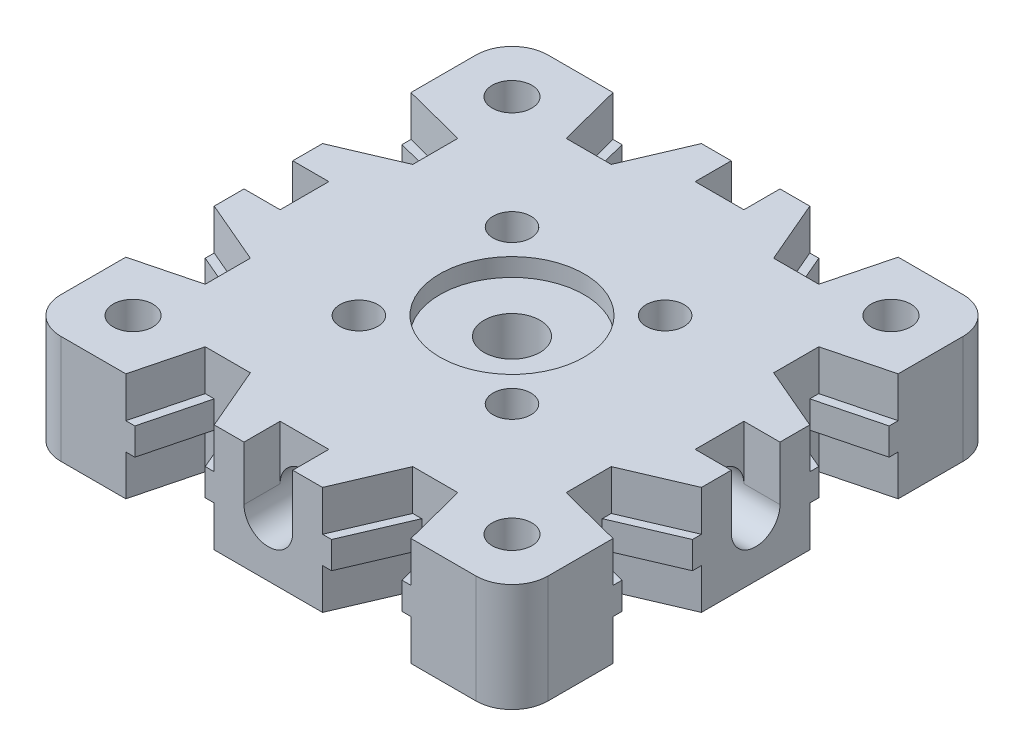
from build123d import *

# Parameters (mm, degrees)
SKETCH_3_W                      = 27
SKETCH_3_H                      = 27
EXTRUDE_1_DEPTH                 = 3
FILLET_1_R                      = 2
SKETCH_4_R                      = 1.1
CUT_EXTRUDE_1_DEPTH             = 6
SKETCH_5_R                      = 1.55
CUT_EXTRUDE_2_DEPTH             = 6
SKETCH_6_R                      = 1.05
CUT_EXTRUDE_3_DEPTH             = 6
PATTERN_CIRCULAR_1_COUNT        = 4
SKETCH_7_R                      = 4
CUT_EXTRUDE_4_DEPTH             = 1
CUT_EXTRUDE_8_DEPTH             = 21.012496096
PATTERN_CIRCULAR_2_COUNT        = 4
PATTERN_CIRCULAR_2_COPY_1_DEPTH = 21.012496096
PATTERN_CIRCULAR_2_COPY_2_DEPTH = 21.012496096
PATTERN_CIRCULAR_2_COPY_3_DEPTH = 21.012496096
SKETCH_12_R                     = 1.35
CUT_EXTRUDE_9_DEPTH             = 8
PATTERN_CIRCULAR_3_COUNT        = 4
EXTRUDE_2_DEPTH                 = 0.75
PATTERN_CIRCULAR_4_COUNT        = 4
PATTERN_CIRCULAR_4_COPY_1_DEPTH = 0.75
PATTERN_CIRCULAR_4_COPY_2_DEPTH = 0.75
PATTERN_CIRCULAR_4_COPY_3_DEPTH = 0.75
SKETCH_22_W                     = 2.7
SKETCH_22_H                     = 3
CUT_EXTRUDE_15_DEPTH            = 2
PATTERN_CIRCULAR_11_COUNT       = 4


with BuildPart() as part:
    # ｽｹｯﾁ3 → ﾎﾞｽ - 押し出し1 (new, symmetric)
    with BuildSketch(Plane(origin=(0, 0, 0), x_dir=(1, 0, 0), z_dir=(0, 1, 0))):
        Rectangle(SKETCH_3_W, SKETCH_3_H)
    extrude(amount=EXTRUDE_1_DEPTH, both=True)

    # ﾌｨﾚｯﾄ1
    fillet_1_edges = [part.edges().sort_by_distance(p)[0] for p in [
        (13.5, 0, 13.5),
        (-13.5, 0, 13.5),
        (-13.5, 0, -13.5),
        (13.5, 0, -13.5),
    ]]
    fillet(fillet_1_edges, radius=FILLET_1_R)

    # ｽｹｯﾁ4 → ｶｯﾄ - 押し出し1 (cut)
    with BuildSketch(Plane(origin=(0, 3, 0), x_dir=(1, 0, 0), z_dir=(0, 1, 0))):
        with Locations(Location((-10.5, 10.5, 0), (0, 0, 270))):
            Circle(SKETCH_4_R)
        with Locations(Location((10.5, 10.5, 0), (0, 0, 270))):
            Circle(SKETCH_4_R)
        with Locations(Location((-10.5, -10.5, 0), (0, 0, 270))):
            Circle(SKETCH_4_R)
        with Locations(Location((10.5, -10.5, 0), (0, 0, 270))):
            Circle(SKETCH_4_R)
    extrude(amount=-CUT_EXTRUDE_1_DEPTH, mode=Mode.SUBTRACT)

    # ｽｹｯﾁ5 → ｶｯﾄ - 押し出し2 (cut)
    with BuildSketch(Plane(origin=(0, 3, 0), x_dir=(1, 0, 0), z_dir=(0, 1, 0))):
        with Locations(Location((0, 0, 0), (0, 0, 270))):
            Circle(SKETCH_5_R)
    extrude(amount=-CUT_EXTRUDE_2_DEPTH, mode=Mode.SUBTRACT)

    # ｽｹｯﾁ6 → ｶｯﾄ - 押し出し3 (cut)
    with BuildSketch(Plane(origin=(0, 3, 0), x_dir=(1, 0, 0), z_dir=(0, 1, 0))):
        with Locations(Location((4.242640687, 4.242640687, 0), (0, 0, 270))):
            Circle(SKETCH_6_R)
    cut_extrude_3 = extrude(amount=-CUT_EXTRUDE_3_DEPTH, mode=Mode.SUBTRACT)

    # 円形ﾊﾟﾀｰﾝ1: ｶｯﾄ - 押し出し3 ×4 about axis
    pattern_circular_1_axis = Axis((0, 0, 0), (0, 1, 0))
    for i in range(1, PATTERN_CIRCULAR_1_COUNT):
        add(cut_extrude_3.rotate(pattern_circular_1_axis, i * 360 / PATTERN_CIRCULAR_1_COUNT), mode=Mode.SUBTRACT)

    # ｽｹｯﾁ7 → ｶｯﾄ - 押し出し4 (cut)
    with BuildSketch(Plane(origin=(0, 3, 0), x_dir=(1, 0, 0), z_dir=(0, 1, 0))):
        with Locations(Location((0, 0, 0), (0, 0, 270))):
            Circle(SKETCH_7_R)
    extrude(amount=-CUT_EXTRUDE_4_DEPTH, mode=Mode.SUBTRACT)

    # ｽｹｯﾁ11 → ｶｯﾄ - 押し出し8 (cut, symmetric)
    with BuildSketch(Plane(origin=(0, 3, 0), x_dir=(1, 0, 0), z_dir=(0, 1, 0))):
        Polygon((-28.082033535, 86.024744916), (3, 13.5), (4.5, 10), (7, 10), (7.9, 13.5), (27.55047658, 89.918520033), (16.532211377, 247.342544779), (-39.100298738, 243.448769662), align=None)
    cut_extrude_8 = extrude(amount=CUT_EXTRUDE_8_DEPTH, both=True, mode=Mode.SUBTRACT)

    # ﾐﾗｰ1: ｶｯﾄ - 押し出し8 across plane
    add(cut_extrude_8.mirror(Plane(origin=(0, 0, 0), x_dir=(0, 0, 1), z_dir=(1, 0, 0))), mode=Mode.SUBTRACT)

    # 円形ﾊﾟﾀｰﾝ2: ｶｯﾄ - 押し出し8 ×4 about axis
    pattern_circular_2_axis = Axis((0, 0, 0), (0, 1, 0))
    for i in range(1, PATTERN_CIRCULAR_2_COUNT):
        add(cut_extrude_8.rotate(pattern_circular_2_axis, i * 360 / PATTERN_CIRCULAR_2_COUNT), mode=Mode.SUBTRACT)

    # 円形ﾊﾟﾀｰﾝ2 copy 1 sketch → 円形ﾊﾟﾀｰﾝ2 copy 1 (cut, symmetric)
    with BuildSketch(Plane.ZX.offset(3)):
        Polygon((-28.082033535, -86.024744916), (3, -13.5), (4.5, -10), (7, -10), (7.9, -13.5), (27.55047658, -89.918520033), (16.532211377, -247.342544779), (-39.100298738, -243.448769662), align=None)
    extrude(amount=PATTERN_CIRCULAR_2_COPY_1_DEPTH, both=True, mode=Mode.SUBTRACT)

    # 円形ﾊﾟﾀｰﾝ2 copy 2 sketch → 円形ﾊﾟﾀｰﾝ2 copy 2 (cut, symmetric)
    with BuildSketch(Plane(origin=(0, 3, 0), x_dir=(1, 0, 0), z_dir=(0, 1, 0))):
        Polygon((-28.082033535, -86.024744916), (3, -13.5), (4.5, -10), (7, -10), (7.9, -13.5), (27.55047658, -89.918520033), (16.532211377, -247.342544779), (-39.100298738, -243.448769662), align=None)
    extrude(amount=PATTERN_CIRCULAR_2_COPY_2_DEPTH, both=True, mode=Mode.SUBTRACT)

    # 円形ﾊﾟﾀｰﾝ2 copy 3 sketch → 円形ﾊﾟﾀｰﾝ2 copy 3 (cut, symmetric)
    with BuildSketch(Plane(origin=(0, 3, 0), x_dir=(0, 0, -1), z_dir=(0, 1, 0))):
        Polygon((-28.082033535, -86.024744916), (3, -13.5), (4.5, -10), (7, -10), (7.9, -13.5), (27.55047658, -89.918520033), (16.532211377, -247.342544779), (-39.100298738, -243.448769662), align=None)
    extrude(amount=PATTERN_CIRCULAR_2_COPY_3_DEPTH, both=True, mode=Mode.SUBTRACT)

    # ｽｹｯﾁ12 → ｶｯﾄ - 押し出し9 (cut)
    with BuildSketch(Plane.XY.offset(13.5)):
        Circle(SKETCH_12_R)
    cut_extrude_9 = extrude(amount=-CUT_EXTRUDE_9_DEPTH, mode=Mode.SUBTRACT)

    # 円形ﾊﾟﾀｰﾝ3: ｶｯﾄ - 押し出し9 ×4 about axis
    pattern_circular_3_axis = Axis((0, 0, 0), (0, 1, 0))
    for i in range(1, PATTERN_CIRCULAR_3_COUNT):
        add(cut_extrude_9.rotate(pattern_circular_3_axis, i * 360 / PATTERN_CIRCULAR_3_COUNT), mode=Mode.SUBTRACT)

    # ｽｹｯﾁ13 → ﾎﾞｽ - 押し出し2 (add, symmetric)
    with BuildSketch(Plane(origin=(0, 0, 0), x_dir=(1, 0, 0), z_dir=(0, 1, 0))):
        Polygon((7.9, 13.5), (7, 10), (6.5, 10), (7.4, 13.5), align=None)
        Polygon((3, 13.5), (3.5, 13.5), (5, 10), (4.5, 10), align=None)
    extrude_2 = extrude(amount=EXTRUDE_2_DEPTH, both=True)

    # ﾐﾗｰ2: ﾎﾞｽ - 押し出し2 across plane
    add(extrude_2.mirror(Plane(origin=(0, 0, 0), x_dir=(0, 0, 1), z_dir=(1, 0, 0))))

    # 円形ﾊﾟﾀｰﾝ4: ﾎﾞｽ - 押し出し2 ×4 about axis
    pattern_circular_4_axis = Axis((0, 0, 0), (0, 1, 0))
    for i in range(1, PATTERN_CIRCULAR_4_COUNT):
        add(extrude_2.rotate(pattern_circular_4_axis, i * 360 / PATTERN_CIRCULAR_4_COUNT))

    # 円形ﾊﾟﾀｰﾝ4 copy 1 sketch → 円形ﾊﾟﾀｰﾝ4 copy 1 (add, symmetric)
    with BuildSketch(Plane.ZX):
        Polygon((7.9, -13.5), (7, -10), (6.5, -10), (7.4, -13.5), align=None)
        Polygon((3, -13.5), (3.5, -13.5), (5, -10), (4.5, -10), align=None)
    extrude(amount=PATTERN_CIRCULAR_4_COPY_1_DEPTH, both=True)

    # 円形ﾊﾟﾀｰﾝ4 copy 2 sketch → 円形ﾊﾟﾀｰﾝ4 copy 2 (add, symmetric)
    with BuildSketch(Plane(origin=(0, 0, 0), x_dir=(1, 0, 0), z_dir=(0, 1, 0))):
        Polygon((7.9, -13.5), (7, -10), (6.5, -10), (7.4, -13.5), align=None)
        Polygon((3, -13.5), (3.5, -13.5), (5, -10), (4.5, -10), align=None)
    extrude(amount=PATTERN_CIRCULAR_4_COPY_2_DEPTH, both=True)

    # 円形ﾊﾟﾀｰﾝ4 copy 3 sketch → 円形ﾊﾟﾀｰﾝ4 copy 3 (add, symmetric)
    with BuildSketch(Plane(origin=(0, 0, 0), x_dir=(0, 0, -1), z_dir=(0, 1, 0))):
        Polygon((7.9, -13.5), (7, -10), (6.5, -10), (7.4, -13.5), align=None)
        Polygon((3, -13.5), (3.5, -13.5), (5, -10), (4.5, -10), align=None)
    extrude(amount=PATTERN_CIRCULAR_4_COPY_3_DEPTH, both=True)

    # ｽｹｯﾁ22 → ｶｯﾄ - 押し出し15 (cut)
    with BuildSketch(Plane.XY.offset(13.5)):
        with Locations((0, 1.5)):
            Rectangle(SKETCH_22_W, SKETCH_22_H)
    cut_extrude_15 = extrude(amount=-CUT_EXTRUDE_15_DEPTH, mode=Mode.SUBTRACT)

    # 円形ﾊﾟﾀｰﾝ11: ｶｯﾄ - 押し出し15 ×4 about axis
    pattern_circular_11_axis = Axis((0, 0, 0), (0, 1, 0))
    for i in range(1, PATTERN_CIRCULAR_11_COUNT):
        add(cut_extrude_15.rotate(pattern_circular_11_axis, i * 360 / PATTERN_CIRCULAR_11_COUNT), mode=Mode.SUBTRACT)


solid = part.part
